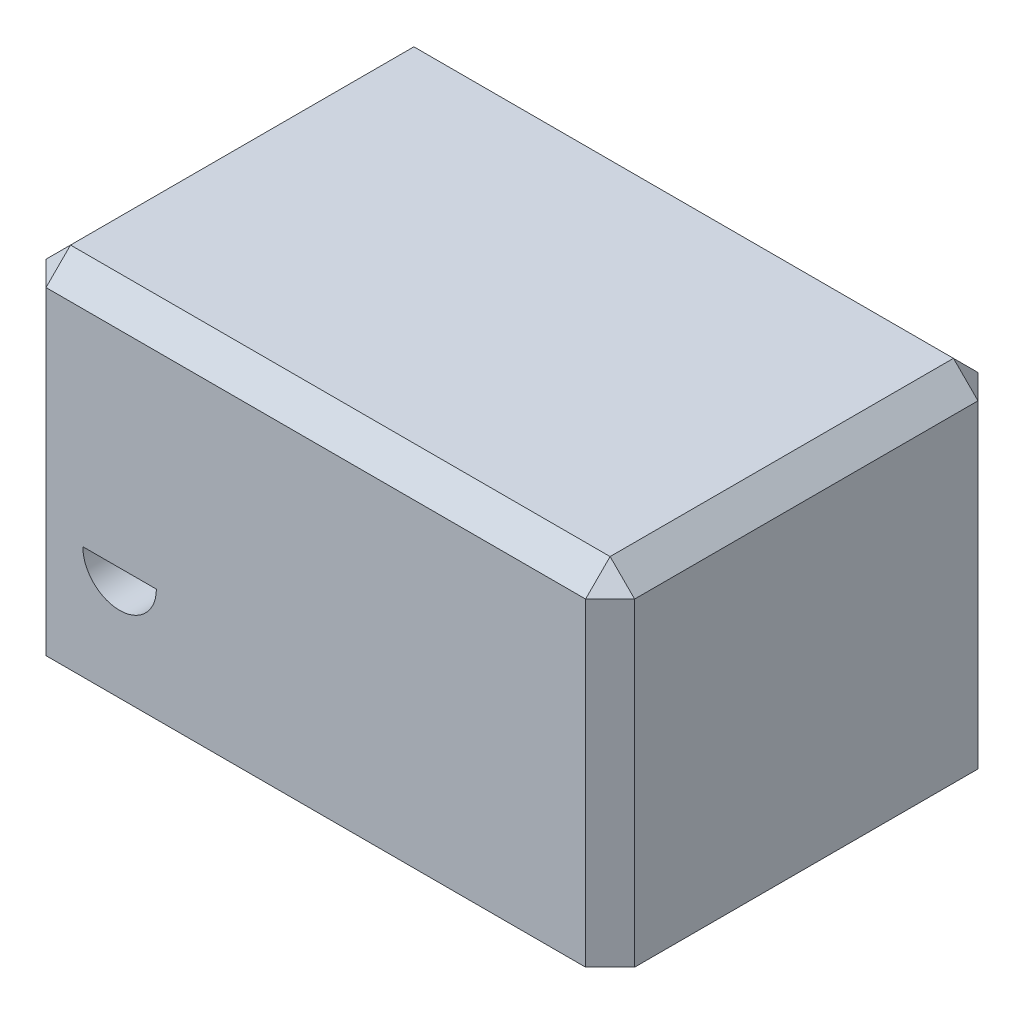
from build123d import *

# Parameters (mm, degrees)
SKETCH1_W           = 120
SKETCH1_H           = 70
BOSS_EXTRUDE3_DEPTH = 80
CHAMFER2_SIZE       = 5
CUT_EXTRUDE1_DEPTH  = 161.312195419


with BuildPart() as part:
    # Sketch1 → Boss-Extrude3 (new body)
    with BuildSketch(Plane.XY):
        with Locations((60, 35)):
            Rectangle(SKETCH1_W, SKETCH1_H)
    extrude(amount=-BOSS_EXTRUDE3_DEPTH)

    # Chamfer2
    chamfer2_edges = [part.edges().sort_by_distance(p)[0] for p in [
        (60, 70, -80),
        (0, 35, -80),
        (0, 35, 0),
        (60, 70, 0),
        (120, 35, 0),
        (0, 70, -40),
        (120, 70, -40),
        (120, 35, -80),
    ]]
    chamfer(chamfer2_edges, length=CHAMFER2_SIZE)

    # Sketch5 → Cut-Extrude1 (cut, through all)
    with BuildSketch(Plane.XY):
        with BuildLine():
            Line((12.5, 23), (27.5, 23))
            ThreePointArc((27.5, 23), (20, 15.5), (12.5, 23))
        make_face()
    extrude(amount=-CUT_EXTRUDE1_DEPTH, mode=Mode.SUBTRACT)


solid = part.part
